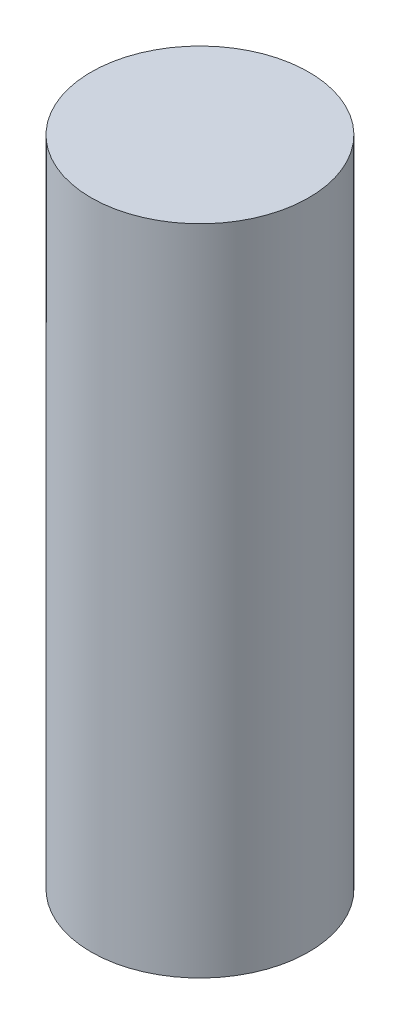
from build123d import *

# Parameters (mm, degrees)
SKETCH_1_R      = 12.5
EXTRUDE_1_DEPTH = 75


with BuildPart() as part:
    # 草图1 → 凸台-拉伸1 (new body)
    with BuildSketch(Plane(origin=(0, 0, 0), x_dir=(1, 0, 0), z_dir=(0, 1, 0))):
        with Locations(Location((0, 0, 0), (0, 0, 270))):
            Circle(SKETCH_1_R)
    extrude(amount=EXTRUDE_1_DEPTH)


solid = part.part
